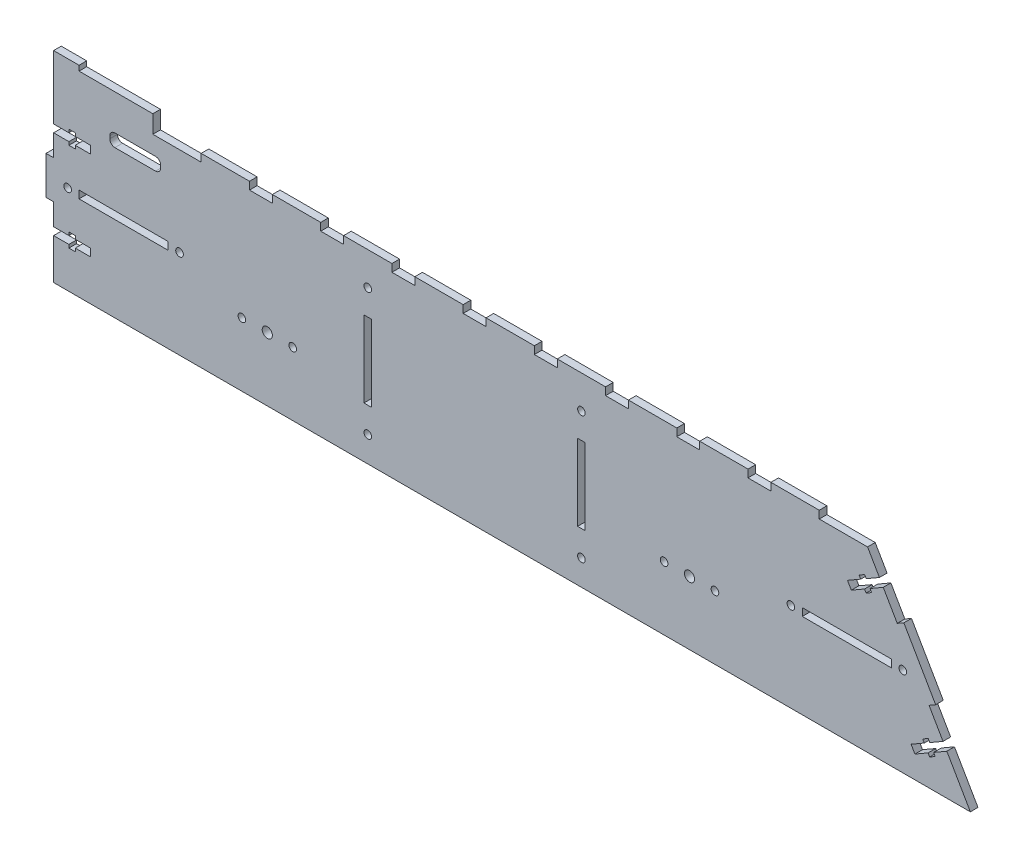
from build123d import *

# Parameters (mm, degrees)
SKETCH_1_R             = 2
SKETCH_1_R_2           = 1.5
EXTRUDE_1_DEPTH        = 3
SKETCH_2_W             = 19
SKETCH_2_H             = 3
EXTRUDE_2_DEPTH        = 3
PATTERN_LINEAR_1_COUNT = 9
PATTERN_LINEAR_1_PITCH = 28
SKETCH_3_W             = 3
SKETCH_3_H             = 30
CUT_EXTRUDE_1_DEPTH    = 3
SKETCH_4_W             = 35
SKETCH_4_H             = 3
CUT_EXTRUDE_2_DEPTH    = 3
SKETCH_5_R             = 1.5
CUT_EXTRUDE_3_DEPTH    = 3
CUT_EXTRUDE_4_DEPTH    = 3
CUT_EXTRUDE_5_DEPTH    = 3
SKETCH_8_W             = 39
SKETCH_8_H             = 3
EXTRUDE_3_DEPTH        = 9
SKETCH_9_W             = 29
SKETCH_9_H             = 3
CUT_EXTRUDE_6_DEPTH    = 2
SKETCH_11_W            = 3
SKETCH_11_H            = 25
EXTRUDE_5_DEPTH        = 3
SKETCH_12_W            = 3
SKETCH_12_H            = 15
EXTRUDE_6_DEPTH        = 3
SKETCH_13_W            = 20
SKETCH_13_H            = 5
CUT_EXTRUDE_7_DEPTH    = 3
FILLET_1_R             = 2


with BuildPart() as part:
    # Эскиз1 → Бобышка-Вытянуть1 (new body)
    with BuildSketch(Plane.XY):
        Polygon((320, 70), (360.414518843, 0), (0, 0), (0, 70), align=None)
        with Locations((84, 25)):
            Circle(SKETCH_1_R, mode=Mode.SUBTRACT)
        with Locations((250, 25)):
            Circle(SKETCH_1_R, mode=Mode.SUBTRACT)
        with Locations((94, 25)):
            Circle(SKETCH_1_R_2, mode=Mode.SUBTRACT)
        with Locations((74, 25)):
            Circle(SKETCH_1_R_2, mode=Mode.SUBTRACT)
        with Locations((240, 25)):
            Circle(SKETCH_1_R_2, mode=Mode.SUBTRACT)
        with Locations((260, 25)):
            Circle(SKETCH_1_R_2, mode=Mode.SUBTRACT)
    extrude(amount=EXTRUDE_1_DEPTH)

    # Эскиз2 → Бобышка-Вытянуть2 (add)
    with BuildSketch(Plane(origin=(0, 70, 0), x_dir=(1, 0, 0), z_dir=(0, 1, 0))):
        with Locations((291.5, -1.5)):
            Rectangle(SKETCH_2_W, SKETCH_2_H)
    extrude_2 = extrude(amount=EXTRUDE_2_DEPTH)

    # Линейный массив1: Бобышка-Вытянуть2 ×9
    with Locations(*[(-i * PATTERN_LINEAR_1_PITCH, 0, 0) for i in range(1, PATTERN_LINEAR_1_COUNT)]):
        add(extrude_2)

    # Эскиз3 → Вырез-Вытянуть1 (cut)
    with BuildSketch(Plane.XY.offset(3)):
        with Locations((207.5, 35)):
            Rectangle(SKETCH_3_W, SKETCH_3_H)
        with Locations((123.5, 35)):
            Rectangle(SKETCH_3_W, SKETCH_3_H)
    extrude(amount=-CUT_EXTRUDE_1_DEPTH, mode=Mode.SUBTRACT)

    # Эскиз4 → Вырез-Вытянуть2 (cut)
    with BuildSketch(Plane.XY.offset(3)):
        with Locations((311.841234018, 35)):
            Rectangle(SKETCH_4_W, SKETCH_4_H)
        with Locations((27.5, 35)):
            Rectangle(SKETCH_4_W, SKETCH_4_H)
    extrude(amount=-CUT_EXTRUDE_2_DEPTH, mode=Mode.SUBTRACT)

    # Эскиз5 → Вырез-Вытянуть3 (cut)
    with BuildSketch(Plane.XY.offset(3)):
        with Locations((5.5, 35)):
            Circle(SKETCH_5_R)
        with Locations((49.5, 35)):
            Circle(SKETCH_5_R)
        with Locations((123.5, 60)):
            Circle(SKETCH_5_R)
        with Locations((123.5, 10)):
            Circle(SKETCH_5_R)
        with Locations((207.5, 60)):
            Circle(SKETCH_5_R)
        with Locations((207.5, 10)):
            Circle(SKETCH_5_R)
        with Locations((289.841234018, 35)):
            Circle(SKETCH_5_R)
        with Locations((333.841234018, 35)):
            Circle(SKETCH_5_R)
    extrude(amount=-CUT_EXTRUDE_3_DEPTH, mode=Mode.SUBTRACT)

    # Эскиз6 → Вырез-Вытянуть4 (cut)
    with BuildSketch(Plane.XY.offset(3)):
        Polygon((0, 54), (6, 54), (6, 55.25), (8.5, 55.25), (8.5, 54), (14.5, 54), (14.5, 51), (8.5, 51), (8.5, 49.75), (6, 49.75), (6, 51), (0, 51), align=None)
        Polygon((0, 19), (6, 19), (6, 20.25), (8.5, 20.25), (8.5, 19), (14.5, 19), (14.5, 16), (8.5, 16), (8.5, 14.75), (6, 14.75), (6, 16), (0, 16), align=None)
    extrude(amount=-CUT_EXTRUDE_4_DEPTH, mode=Mode.SUBTRACT)

    # Эскиз7 → Вырез-Вытянуть5 (cut)
    with BuildSketch(Plane.XY.offset(3)):
        Polygon((324.664518843, 61.920816371), (319.468366421, 58.920816371), (318.843366421, 60.003348125), (316.678302911, 58.753348125), (317.303302911, 57.670816371), (312.107150488, 54.670816371), (313.607150488, 52.072740159), (318.803302911, 55.072740159), (319.428302911, 53.990208405), (321.593366421, 55.240208405), (320.968366421, 56.322740159), (326.164518843, 59.322740159), align=None)
        Polygon((349.664518843, 18.619546181), (344.468366421, 15.619546181), (343.843366421, 16.702077936), (341.678302911, 15.452077936), (342.303302911, 14.369546181), (337.107150488, 11.369546181), (338.607150488, 8.77146997), (343.803302911, 11.77146997), (344.428302911, 10.688938215), (346.593366421, 11.938938215), (345.968366421, 13.02146997), (351.164518843, 16.02146997), align=None)
    extrude(amount=-CUT_EXTRUDE_5_DEPTH, mode=Mode.SUBTRACT)

    # Эскиз8 → Бобышка-Вытянуть3 (add)
    with BuildSketch(Plane(origin=(0, 70, 0), x_dir=(1, 0, 0), z_dir=(0, 1, 0))):
        with Locations((19.5, -1.5)):
            Rectangle(SKETCH_8_W, SKETCH_8_H)
    extrude(amount=EXTRUDE_3_DEPTH)

    # Эскиз9 → Вырез-Вытянуть6 (cut)
    with BuildSketch(Plane(origin=(0, 79, 0), x_dir=(1, 0, 0), z_dir=(0, 1, 0))):
        with Locations((24.5, -1.5)):
            Rectangle(SKETCH_9_W, SKETCH_9_H)
    extrude(amount=-CUT_EXTRUDE_6_DEPTH, mode=Mode.SUBTRACT)

    # Эскиз11 → Бобышка-Вытянуть5 (add)
    with BuildSketch(Plane(origin=(270.310889132, 156.064064606, 0), x_dir=(0, 0, -1), z_dir=(0.8660254037844416, 0.4999999999999949, 0))):
        with Locations((-1.5, -135.207259422)):
            Rectangle(SKETCH_11_W, SKETCH_11_H)
    extrude(amount=EXTRUDE_5_DEPTH)

    # Эскиз12 → Бобышка-Вытянуть6 (add)
    with BuildSketch(Plane.ZY):
        with Locations((1.5, 35)):
            Rectangle(SKETCH_12_W, SKETCH_12_H)
    extrude(amount=EXTRUDE_6_DEPTH)

    # Эскиз13 → Вырез-Вытянуть7 (cut)
    with BuildSketch(Plane.XY.offset(3)):
        with Locations((32.07564967, 60.49517076)):
            Rectangle(SKETCH_13_W, SKETCH_13_H)
    extrude(amount=-CUT_EXTRUDE_7_DEPTH, mode=Mode.SUBTRACT)

    # Скругление1
    fillet_1_edges = [part.edges().sort_by_distance(p)[0] for p in [
        (22.07564967, 57.99517076, 1.5),
        (22.07564967, 62.99517076, 1.5),
        (42.07564967, 62.99517076, 1.5),
        (42.07564967, 57.99517076, 1.5),
    ]]
    fillet(fillet_1_edges, radius=FILLET_1_R)


solid = part.part
